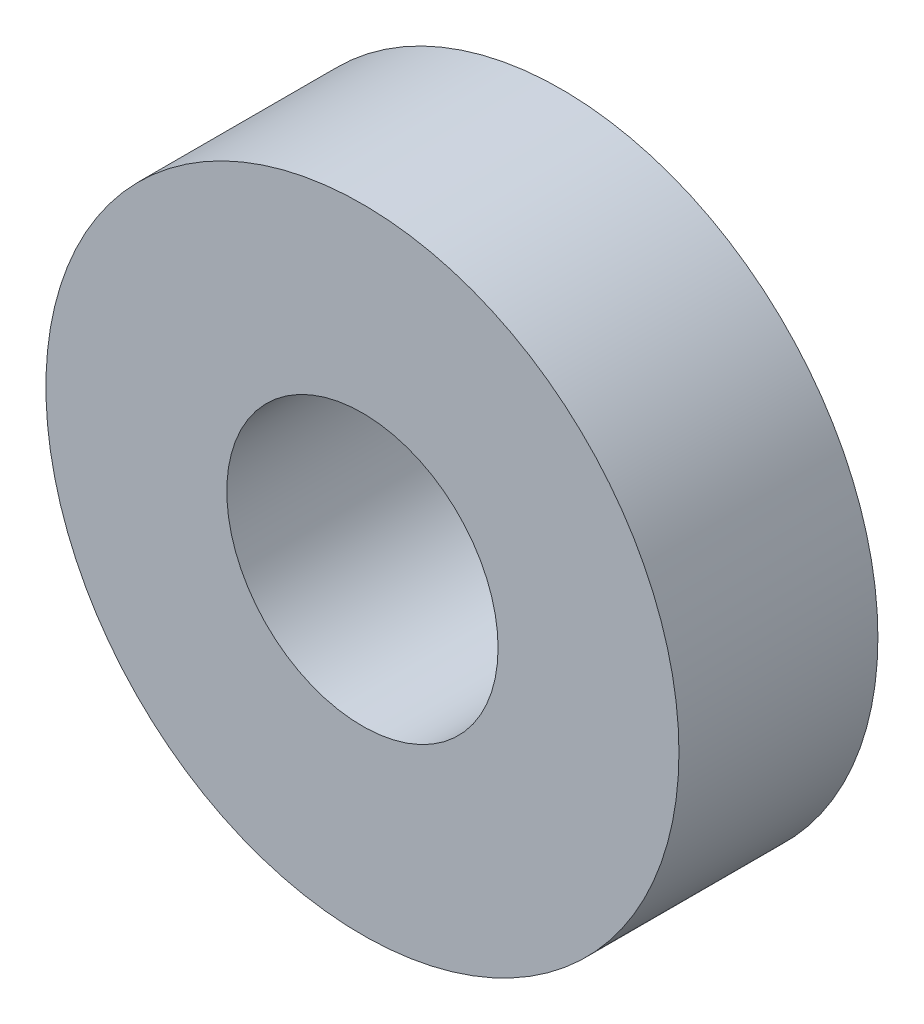
from build123d import *

# Parameters (mm, degrees)
SKETCH1_R           = 17.5
SKETCH1_R_2         = 7.5
BOSS_EXTRUDE1_DEPTH = 11


with BuildPart() as part:
    # Sketch1 → Boss-Extrude1 (new body)
    with BuildSketch(Plane.XY):
        Circle(SKETCH1_R)
        Circle(SKETCH1_R_2, mode=Mode.SUBTRACT)
    extrude(amount=BOSS_EXTRUDE1_DEPTH)


solid = part.part
